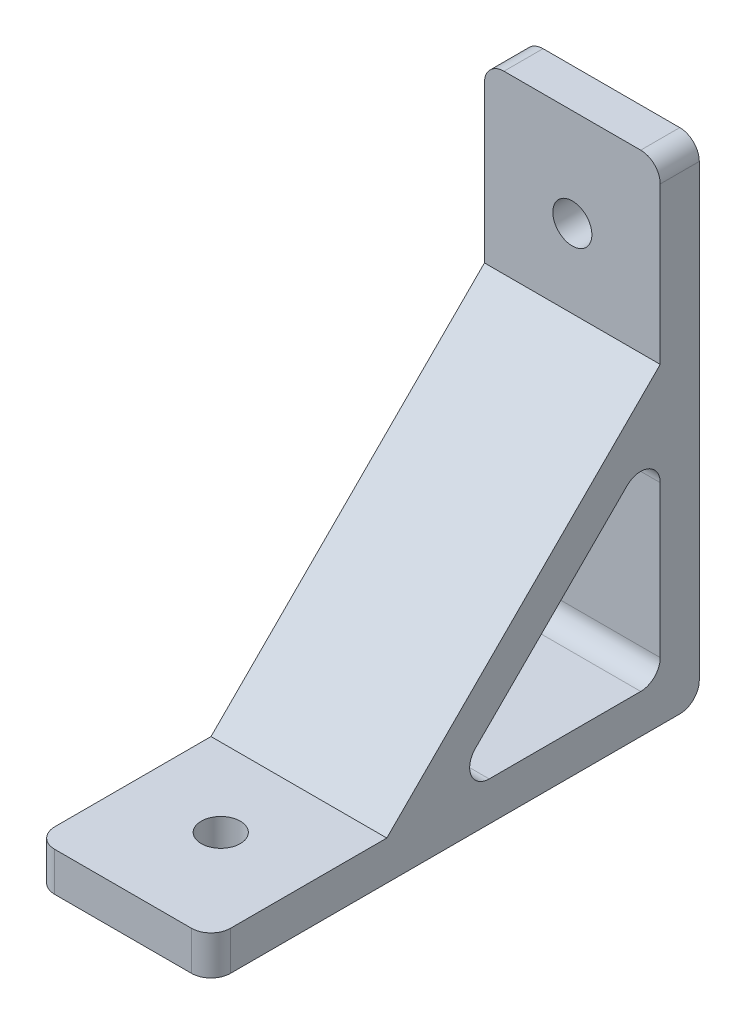
from build123d import *

# Parameters (mm, degrees)
SKETCH1_W               = 36
SKETCH1_H               = 100
BOSS_EXTRUDE1_DEPTH     = 100
CUT_EXTRUDE1_DEPTH      = 118.45637488
CUT_EXTRUDE1_DEPTH_BACK = 118.45637488
CUT_EXTRUDE5_DEPTH      = 118.45637488
CUT_EXTRUDE5_DEPTH_BACK = 118.45637488
FILLET3_R               = 4
CUT_EXTRUDE6_DEPTH      = 107.244999882
CUT_EXTRUDE6_DEPTH_BACK = 107.244999882
SKETCH9_R               = 4
CUT_EXTRUDE7_DEPTH      = 138.069325525
CUT_EXTRUDE7_DEPTH_BACK = 138.069325525
SKETCH10_R              = 4


with BuildPart() as part:
    # Sketch1 → Boss-Extrude1 (new body)
    with BuildSketch(Plane(origin=(0, 0, 0), x_dir=(1, 0, 0), z_dir=(0, 1, 0))):
        Rectangle(SKETCH1_W, SKETCH1_H)
    extrude(amount=BOSS_EXTRUDE1_DEPTH)

    # Sketch2 → Cut-Extrude1 (cut, two sides: drawn at the far end of the back side and taken through both)
    with BuildSketch(Plane.ZY.offset(18).offset(-CUT_EXTRUDE1_DEPTH_BACK)):
        Polygon((50, 100), (-42, 100), (-42, 64), (14, 8), (50, 8), align=None)
    extrude(amount=CUT_EXTRUDE1_DEPTH + CUT_EXTRUDE1_DEPTH_BACK, mode=Mode.SUBTRACT)

    # Sketch8 → Cut-Extrude5 (cut, two sides: drawn at the far end of the back side and taken through both)
    with BuildSketch(Plane(origin=(18, 0, 0), x_dir=(0, 0, -1), z_dir=(1, 0, 0)).offset(-CUT_EXTRUDE5_DEPTH_BACK)):
        with BuildLine():
            Line((42, 43.029437252), (42, 12))
            ThreePointArc((42, 12), (40.828427125, 9.171572875), (38, 8))
            Line((38, 8), (6.970562748, 8))
            ThreePointArc((6.970562748, 8), (3.275044618, 10.469266271), (4.142135624, 14.828427125))
            Line((4.142135624, 14.828427125), (35.171572875, 45.857864376))
            ThreePointArc((35.171572875, 45.857864376), (39.530733729, 46.724955382), (42, 43.029437252))
        make_face()
    extrude(amount=CUT_EXTRUDE5_DEPTH + CUT_EXTRUDE5_DEPTH_BACK, mode=Mode.SUBTRACT)

    # Fillet3
    fillet3_edges = [part.edges().sort_by_distance(p)[0] for p in [
        (-18, 100, -46),
        (18, 100, -46),
        (18, 4, 50),
        (-18, 4, 50),
        (0, 0, -50),
    ]]
    fillet(fillet3_edges, radius=FILLET3_R)

    # Sketch9 → Cut-Extrude6 (cut, two sides: drawn at the far end of the back side and taken through both)
    with BuildSketch(Plane(origin=(0, 8, 0), x_dir=(1, 0, 0), z_dir=(0, 1, 0)).offset(-CUT_EXTRUDE6_DEPTH_BACK)):
        with Locations(Location((0, -30, 0), (0, 0, 270))):
            Circle(SKETCH9_R)
    extrude(amount=CUT_EXTRUDE6_DEPTH + CUT_EXTRUDE6_DEPTH_BACK, mode=Mode.SUBTRACT)

    # Sketch10 → Cut-Extrude7 (cut, two sides: drawn at the far end of the back side and taken through both)
    with BuildSketch(Plane.XY.offset(-42).offset(-CUT_EXTRUDE7_DEPTH_BACK)):
        with Locations((0, 80)):
            Circle(SKETCH10_R)
    extrude(amount=CUT_EXTRUDE7_DEPTH + CUT_EXTRUDE7_DEPTH_BACK, mode=Mode.SUBTRACT)


solid = part.part
